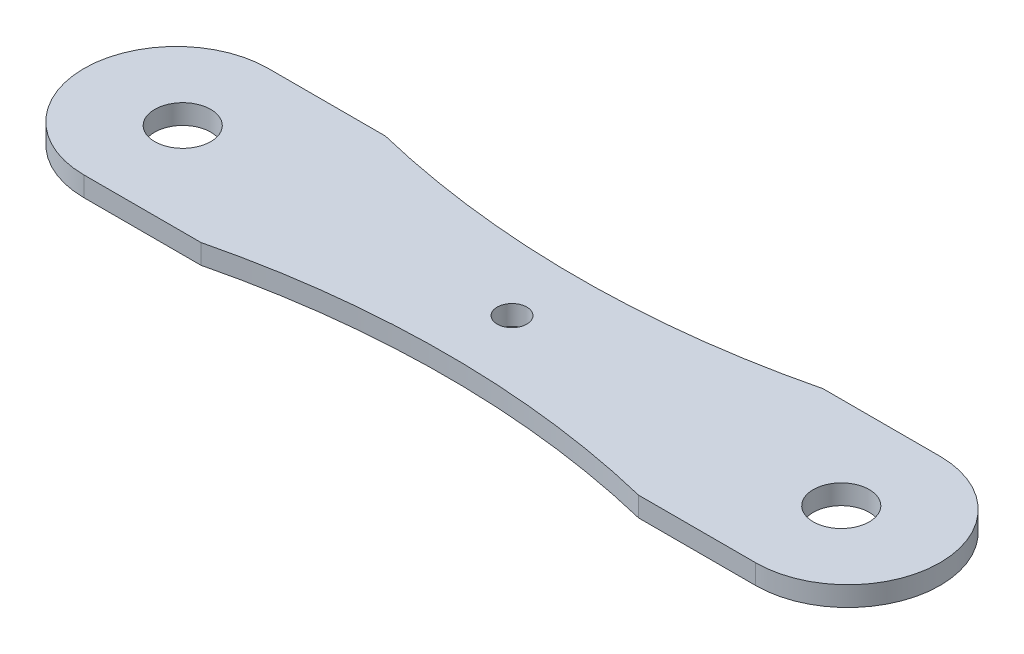
from build123d import *

# Parameters (mm, degrees)
SKETCH_1_W          = 130
SKETCH_1_H          = 28
EXTRUDE_1_DEPTH     = 3
CUT_EXTRUDE_1_REACH = 68.558
SKETCH_2_R          = 4.25
SKETCH_2_R_2        = 2.25
FILLET_1_RADIUS     = 14
FILLET_1_LENGTH     = 3
CUT_EXTRUDE_3_REACH = 68.558
SKETCH_4_R          = 140
FILLET_2_RADIUS     = 14
FILLET_2_LENGTH     = 3


with BuildPart() as part:
    # 草图1 → 凸台-拉伸1 (new body)
    with BuildSketch(Plane(origin=(0, 0, 0), x_dir=(1, 0, 0), z_dir=(0, 1, 0))):
        Rectangle(SKETCH_1_W, SKETCH_1_H)
    extrude(amount=EXTRUDE_1_DEPTH)

    # 草图2 → 切除-拉伸1 (cut, up to next)
    with BuildSketch(Plane(origin=(0, 3, 0), x_dir=(1, 0, 0), z_dir=(0, 1, 0)), mode=Mode.PRIVATE) as cut_extrude_1_sk1:
        with Locations(Location((-50, 0, 0), (0, 0, 270))):
            Circle(SKETCH_2_R)
    cut_extrude_1_tool1 = extrude(cut_extrude_1_sk1.sketch, amount=-CUT_EXTRUDE_1_REACH, mode=Mode.PRIVATE) & part.part
    # 草图2 → 切除-拉伸1 (cut, up to next)
    with BuildSketch(Plane(origin=(0, 3, 0), x_dir=(1, 0, 0), z_dir=(0, 1, 0)), mode=Mode.PRIVATE) as cut_extrude_1_sk2:
        with Locations(Location((50, 0, 0), (0, 0, 270))):
            Circle(SKETCH_2_R)
    cut_extrude_1_tool2 = extrude(cut_extrude_1_sk2.sketch, amount=-CUT_EXTRUDE_1_REACH, mode=Mode.PRIVATE) & part.part
    # 草图2 → 切除-拉伸1 (cut, up to next)
    with BuildSketch(Plane(origin=(0, 3, 0), x_dir=(1, 0, 0), z_dir=(0, 1, 0)), mode=Mode.PRIVATE) as cut_extrude_1_sk3:
        with Locations(Location((0, 0, 0), (0, 0, 270))):
            Circle(SKETCH_2_R_2)
    cut_extrude_1_tool3 = extrude(cut_extrude_1_sk3.sketch, amount=-CUT_EXTRUDE_1_REACH, mode=Mode.PRIVATE) & part.part
    add(cut_extrude_1_tool1.solids().sort_by_distance((-50, 3, 0))[0], mode=Mode.SUBTRACT)
    add(cut_extrude_1_tool2.solids().sort_by_distance((50, 3, 0))[0], mode=Mode.SUBTRACT)
    add(cut_extrude_1_tool3.solids().sort_by_distance((0, 3, 0))[0], mode=Mode.SUBTRACT)

    # 圆角1: full round fillet: the end face becomes a half cylinder, R = half its width
    fillet_1_face = Plane((-65, 1.5, 0), x_dir=(0, 1, 0), z_dir=(-1, 0, 0))  # on the end face: x along it, z out of the body
    fillet_1_slab = fillet_1_face.offset(-FILLET_1_RADIUS / 2) * Box(FILLET_1_LENGTH, 2 * FILLET_1_RADIUS, FILLET_1_RADIUS, mode=Mode.PRIVATE)  # the body's end, R deep
    fillet_1_round = Plane((-51, 1.5, 0), x_dir=(-1, 0, 0), z_dir=(0, 1, 0)) * Cylinder(FILLET_1_RADIUS, FILLET_1_LENGTH, mode=Mode.PRIVATE)  # its axis R under the face
    add(fillet_1_slab - fillet_1_round, mode=Mode.SUBTRACT)

    # 草图4 → 切除-拉伸3 (cut, up to next)
    with BuildSketch(Plane(origin=(0, 3, 0), x_dir=(1, 0, 0), z_dir=(0, 1, 0)), mode=Mode.PRIVATE) as cut_extrude_3_sk1:
        with Locations((0, 150)):
            Circle(SKETCH_4_R)
    cut_extrude_3_tool1 = extrude(cut_extrude_3_sk1.sketch, amount=-CUT_EXTRUDE_3_REACH, mode=Mode.PRIVATE) & part.part
    cut_extrude_3 = cut_extrude_3_tool1.solids().sort_by_distance((0, 3, -150))[0]
    add(cut_extrude_3, mode=Mode.SUBTRACT)

    # 镜向1: 切除-拉伸3 across plane
    add(cut_extrude_3.mirror(Plane.XY), mode=Mode.SUBTRACT)

    # 圆角2: full round fillet: the end face becomes a half cylinder, R = half its width
    fillet_2_face = Plane((65, 1.5, 0), x_dir=(0, -1, 0), z_dir=(1, 0, 0))  # on the end face: x along it, z out of the body
    fillet_2_slab = fillet_2_face.offset(-FILLET_2_RADIUS / 2) * Box(FILLET_2_LENGTH, 2 * FILLET_2_RADIUS, FILLET_2_RADIUS, mode=Mode.PRIVATE)  # the body's end, R deep
    fillet_2_round = Plane((51, 1.5, 0), x_dir=(1, 0, 0), z_dir=(0, -1, 0)) * Cylinder(FILLET_2_RADIUS, FILLET_2_LENGTH, mode=Mode.PRIVATE)  # its axis R under the face
    add(fillet_2_slab - fillet_2_round, mode=Mode.SUBTRACT)


solid = part.part
